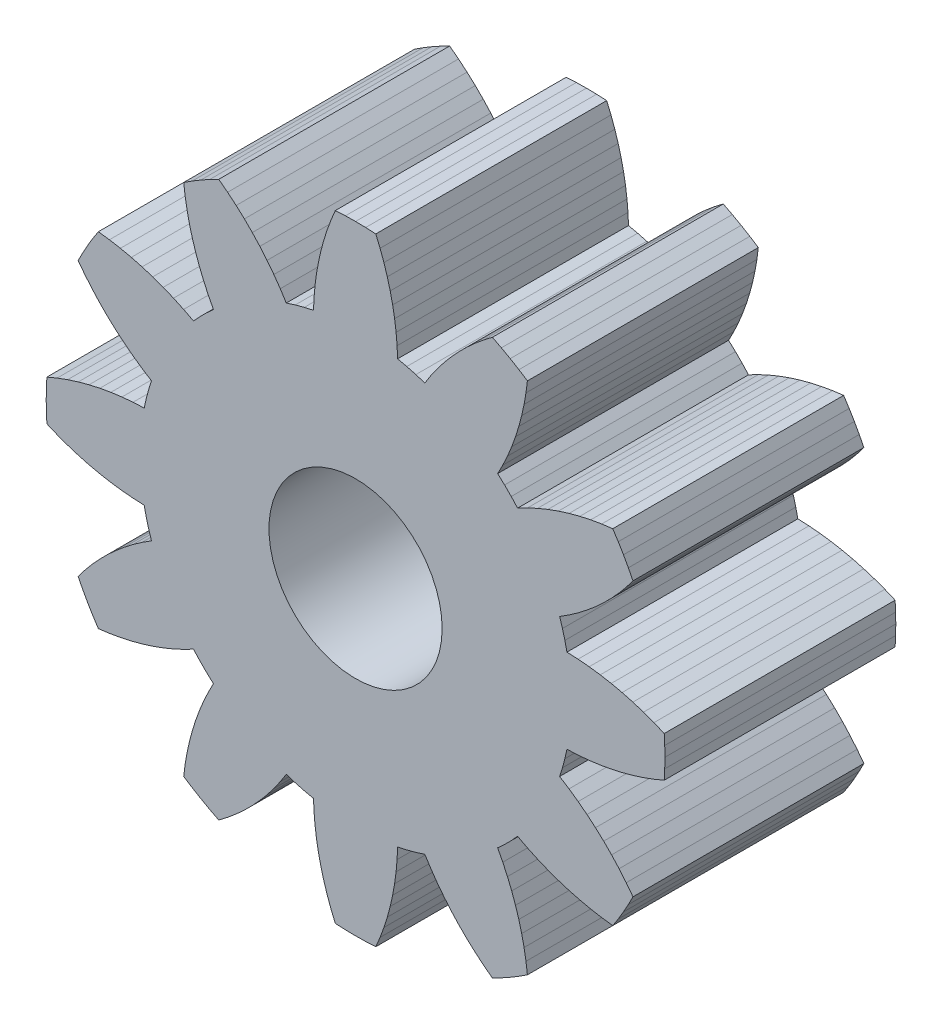
from build123d import *

# Parameters (mm, degrees)
BOSS_EXTRUDE1_DEPTH = 4
CUT_EXTRUDE1_REACH  = 10.57
SKETCH2_R           = 1.5


with BuildPart() as part:
    # Sketch1 → Boss-Extrude1 (new body)
    with BuildSketch(Plane.XY):
        Polygon((-0.728371799, -3.661772258), (-0.719457567, -3.854738951), (-0.702143252, -4.047133923), (-0.676461816, -4.238591194), (-0.642462075, -4.428748131), (-0.600208461, -4.617242813), (-0.549781442, -4.803717136), (-0.491276622, -4.987816811), (-0.424805284, -5.169192314), (-0.35049364, -5.347499371), (-0.175340697, -5.356103897), (0, -5.358973503), (0.175340697, -5.356103897), (0.35049364, -5.347499371), (0.424805284, -5.169192314), (0.491276622, -4.987816811), (0.549781442, -4.803717136), (0.600208461, -4.617242813), (0.642462075, -4.428748131), (0.676461816, -4.238591194), (0.702143252, -4.047133923), (0.719457567, -3.854738951), (0.728371799, -3.661772251), (0.887402833, -3.626515865), (1.044744611, -3.584356308), (1.200097648, -3.535373698), (1.304300946, -3.69803064), (1.415493068, -3.855992415), (1.53346248, -4.008958558), (1.657985588, -4.156639426), (1.788825632, -4.298753802), (1.925733873, -4.435031794), (2.068450371, -4.565214378), (2.21670399, -4.689054503), (2.370213289, -4.806317121), (2.52620245, -4.726192389), (2.679486752, -4.641007192), (2.829901447, -4.550851692), (2.977286081, -4.455823482), (2.952488324, -4.264249219), (2.91936644, -4.073937757), (2.877983263, -3.885250352), (2.828417182, -3.698545341), (2.770762543, -3.514177351), (2.705128714, -3.332496742), (2.631640855, -3.153849164), (2.550438005, -2.978573073), (2.461674607, -2.807001893), (2.581771329, -2.69695345), (2.696953527, -2.581771314), (2.807001899, -2.46167461), (2.978573073, -2.550438005), (3.153849164, -2.631640855), (3.332496742, -2.705128714), (3.514177351, -2.770762543), (3.698545341, -2.828417182), (3.885250352, -2.877983263), (4.073937757, -2.91936644), (4.264249219, -2.952488324), (4.455823482, -2.977286081), (4.550851692, -2.829901447), (4.641007192, -2.679486752), (4.726192389, -2.52620245), (4.806317121, -2.370213289), (4.689054503, -2.21670399), (4.565214378, -2.068450371), (4.435031794, -1.925733873), (4.298753802, -1.788825632), (4.156639426, -1.657985588), (4.008958558, -1.53346248), (3.855992415, -1.415493068), (3.69803064, -1.304300946), (3.535373692, -1.200097644), (3.584356283, -1.044744536), (3.626515924, -0.887402781), (3.661772258, -0.728371799), (3.854738951, -0.719457567), (4.047133923, -0.702143252), (4.238591194, -0.676461816), (4.428748131, -0.642462075), (4.617242813, -0.600208461), (4.803717136, -0.549781442), (4.987816811, -0.491276622), (5.169192314, -0.424805284), (5.347499371, -0.35049364), (5.356103897, -0.175340697), (5.358973503, 0), (5.356103897, 0.175340697), (5.347499371, 0.35049364), (5.169192314, 0.424805284), (4.987816811, 0.491276622), (4.803717136, 0.549781442), (4.617242813, 0.600208461), (4.428748131, 0.642462075), (4.238591194, 0.676461816), (4.047133923, 0.702143252), (3.854738951, 0.719457567), (3.661772251, 0.728371799), (3.626515865, 0.887402833), (3.584356308, 1.044744611), (3.535373698, 1.200097648), (3.69803064, 1.304300946), (3.855992415, 1.415493068), (4.008958558, 1.53346248), (4.156639426, 1.657985588), (4.298753802, 1.788825632), (4.435031794, 1.925733873), (4.565214378, 2.068450371), (4.689054503, 2.21670399), (4.806317121, 2.370213289), (4.726192389, 2.52620245), (4.641007192, 2.679486752), (4.550851692, 2.829901447), (4.455823482, 2.977286081), (4.264249219, 2.952488324), (4.073937757, 2.91936644), (3.885250352, 2.877983263), (3.698545341, 2.828417182), (3.514177351, 2.770762543), (3.332496742, 2.705128714), (3.153849164, 2.631640855), (2.978573073, 2.550438005), (2.807001893, 2.461674607), (2.69695345, 2.581771329), (2.581771314, 2.696953527), (2.46167461, 2.807001899), (2.550438005, 2.978573073), (2.631640855, 3.153849164), (2.705128714, 3.332496742), (2.770762543, 3.514177351), (2.828417182, 3.698545341), (2.877983263, 3.885250352), (2.91936644, 4.073937757), (2.952488324, 4.264249219), (2.977286081, 4.455823482), (2.829901447, 4.550851692), (2.679486752, 4.641007192), (2.52620245, 4.726192389), (2.370213289, 4.806317121), (2.21670399, 4.689054503), (2.068450371, 4.565214378), (1.925733873, 4.435031794), (1.788825632, 4.298753802), (1.657985588, 4.156639426), (1.53346248, 4.008958558), (1.415493068, 3.855992415), (1.304300946, 3.69803064), (1.200097644, 3.535373692), (1.044744536, 3.584356283), (0.887402781, 3.626515924), (0.728371799, 3.661772258), (0.719457567, 3.854738951), (0.702143252, 4.047133923), (0.676461816, 4.238591194), (0.642462075, 4.428748131), (0.600208461, 4.617242813), (0.549781442, 4.803717136), (0.491276622, 4.987816811), (0.424805284, 5.169192314), (0.35049364, 5.347499371), (0.175340697, 5.356103897), (0, 5.358973503), (-0.175340697, 5.356103897), (-0.35049364, 5.347499371), (-0.424805284, 5.169192314), (-0.491276622, 4.987816811), (-0.549781442, 4.803717136), (-0.600208461, 4.617242813), (-0.642462075, 4.428748131), (-0.676461816, 4.238591194), (-0.702143252, 4.047133923), (-0.719457567, 3.854738951), (-0.728371799, 3.661772251), (-0.887402833, 3.626515865), (-1.044744611, 3.584356308), (-1.200097648, 3.535373698), (-1.304300946, 3.69803064), (-1.415493068, 3.855992415), (-1.53346248, 4.008958558), (-1.657985588, 4.156639426), (-1.788825632, 4.298753802), (-1.925733873, 4.435031794), (-2.068450371, 4.565214378), (-2.21670399, 4.689054503), (-2.370213289, 4.806317121), (-2.52620245, 4.726192389), (-2.679486752, 4.641007192), (-2.829901447, 4.550851692), (-2.977286081, 4.455823482), (-2.952488324, 4.264249219), (-2.91936644, 4.073937757), (-2.877983263, 3.885250352), (-2.828417182, 3.698545341), (-2.770762543, 3.514177351), (-2.705128714, 3.332496742), (-2.631640855, 3.153849164), (-2.550438005, 2.978573073), (-2.461674607, 2.807001893), (-2.581771329, 2.69695345), (-2.696953527, 2.581771314), (-2.807001899, 2.46167461), (-2.978573073, 2.550438005), (-3.153849164, 2.631640855), (-3.332496742, 2.705128714), (-3.514177351, 2.770762543), (-3.698545341, 2.828417182), (-3.885250352, 2.877983263), (-4.073937757, 2.91936644), (-4.264249219, 2.952488324), (-4.455823482, 2.977286081), (-4.550851692, 2.829901447), (-4.641007192, 2.679486752), (-4.726192389, 2.52620245), (-4.806317121, 2.370213289), (-4.689054503, 2.21670399), (-4.565214378, 2.068450371), (-4.435031794, 1.925733873), (-4.298753802, 1.788825632), (-4.156639426, 1.657985588), (-4.008958558, 1.53346248), (-3.855992415, 1.415493068), (-3.69803064, 1.304300946), (-3.535373692, 1.200097644), (-3.584356283, 1.044744536), (-3.626515924, 0.887402781), (-3.661772258, 0.728371799), (-3.854738951, 0.719457567), (-4.047133923, 0.702143252), (-4.238591194, 0.676461816), (-4.428748131, 0.642462075), (-4.617242813, 0.600208461), (-4.803717136, 0.549781442), (-4.987816811, 0.491276622), (-5.169192314, 0.424805284), (-5.347499371, 0.35049364), (-5.356103897, 0.175340697), (-5.358973503, 0), (-5.356103897, -0.175340697), (-5.347499371, -0.35049364), (-5.169192314, -0.424805284), (-4.987816811, -0.491276622), (-4.803717136, -0.549781442), (-4.617242813, -0.600208461), (-4.428748131, -0.642462075), (-4.238591194, -0.676461816), (-4.047133923, -0.702143252), (-3.854738951, -0.719457567), (-3.661772251, -0.728371799), (-3.626515865, -0.887402833), (-3.584356308, -1.044744611), (-3.535373698, -1.200097648), (-3.69803064, -1.304300946), (-3.855992415, -1.415493068), (-4.008958558, -1.53346248), (-4.156639426, -1.657985588), (-4.298753802, -1.788825632), (-4.435031794, -1.925733873), (-4.565214378, -2.068450371), (-4.689054503, -2.21670399), (-4.806317121, -2.370213289), (-4.726192389, -2.52620245), (-4.641007192, -2.679486752), (-4.550851692, -2.829901447), (-4.455823482, -2.977286081), (-4.264249219, -2.952488324), (-4.073937757, -2.91936644), (-3.885250352, -2.877983263), (-3.698545341, -2.828417182), (-3.514177351, -2.770762543), (-3.332496742, -2.705128714), (-3.153849164, -2.631640855), (-2.978573073, -2.550438005), (-2.807001893, -2.461674607), (-2.69695345, -2.581771329), (-2.581771314, -2.696953527), (-2.46167461, -2.807001899), (-2.550438005, -2.978573073), (-2.631640855, -3.153849164), (-2.705128714, -3.332496742), (-2.770762543, -3.514177351), (-2.828417182, -3.698545341), (-2.877983263, -3.885250352), (-2.91936644, -4.073937757), (-2.952488324, -4.264249219), (-2.977286081, -4.455823482), (-2.829901447, -4.550851692), (-2.679486752, -4.641007192), (-2.52620245, -4.726192389), (-2.370213289, -4.806317121), (-2.21670399, -4.689054503), (-2.068450371, -4.565214378), (-1.925733873, -4.435031794), (-1.788825632, -4.298753802), (-1.657985588, -4.156639426), (-1.53346248, -4.008958558), (-1.415493068, -3.855992415), (-1.304300946, -3.69803064), (-1.200097644, -3.535373692), (-1.044744536, -3.584356283), (-0.887402781, -3.626515924), align=None)
    extrude(amount=BOSS_EXTRUDE1_DEPTH)

    # Sketch2 → Cut-Extrude1 (cut, up to next)
    with BuildSketch(Plane.XY.offset(4), mode=Mode.PRIVATE) as cut_extrude1_sk1:
        Circle(SKETCH2_R)
    cut_extrude1_tool1 = extrude(cut_extrude1_sk1.sketch, amount=-CUT_EXTRUDE1_REACH, mode=Mode.PRIVATE) & part.part
    add(cut_extrude1_tool1.solids().sort_by_distance((0, 0, 4))[0], mode=Mode.SUBTRACT)


solid = part.part
